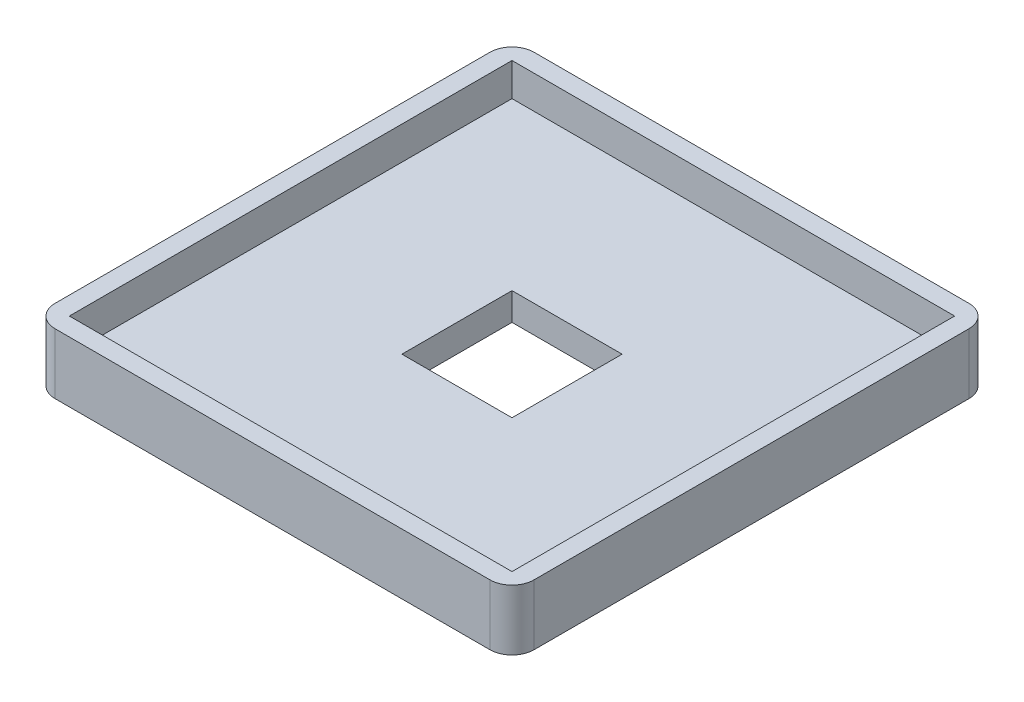
from build123d import *

# Parameters (mm, degrees)
SKETCH1_W           = 43.5
SKETCH1_H           = 43.5
BOSS_EXTRUDE2_DEPTH = 2.5
SKETCH3_W           = 43.5
SKETCH3_H           = 43.5
SKETCH3_W_2         = 40.2
SKETCH3_H_2         = 40.2
BOSS_EXTRUDE3_DEPTH = 3
SKETCH4_W           = 10
SKETCH4_H           = 10
CUT_EXTRUDE1_DEPTH  = 5
FILLET1_R           = 2


with BuildPart() as part:
    # Sketch1 → Boss-Extrude2 (new body)
    with BuildSketch(Plane(origin=(0, 0, 0), x_dir=(1, 0, 0), z_dir=(0, 1, 0))):
        Rectangle(SKETCH1_W, SKETCH1_H)
    extrude(amount=BOSS_EXTRUDE2_DEPTH)

    # Sketch3 → Boss-Extrude3 (add)
    with BuildSketch(Plane(origin=(0, 2.5, 0), x_dir=(1, 0, 0), z_dir=(0, 1, 0))):
        Rectangle(SKETCH3_W, SKETCH3_H)
        Rectangle(SKETCH3_W_2, SKETCH3_H_2, mode=Mode.SUBTRACT)
    extrude(amount=BOSS_EXTRUDE3_DEPTH)

    # Sketch4 → Cut-Extrude1 (cut)
    with BuildSketch(Plane(origin=(0, 2.5, 0), x_dir=(1, 0, 0), z_dir=(0, 1, 0))):
        Rectangle(SKETCH4_W, SKETCH4_H)
    extrude(amount=-CUT_EXTRUDE1_DEPTH, mode=Mode.SUBTRACT)

    # Fillet1
    fillet1_edges = [part.edges().sort_by_distance(p)[0] for p in [
        (21.75, 2.75, 21.75),
        (-21.75, 2.75, 21.75),
        (-21.75, 2.75, -21.75),
        (21.75, 2.75, -21.75),
    ]]
    fillet(fillet1_edges, radius=FILLET1_R)


solid = part.part
